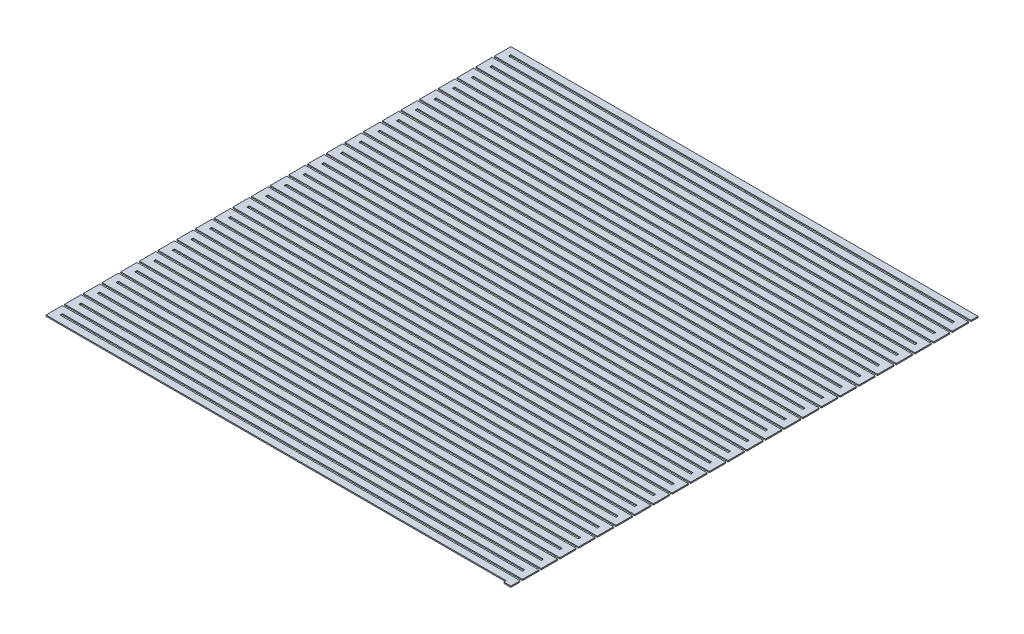
from build123d import *

# Parameters (mm, degrees)
EXTRUDED_OBJECT_DEPTH = 0.05
BOSS_EXTRUDE1_DEPTH   = 0.05
LPATTERN2_COUNT       = 24
LPATTERN2_PITCH       = 0.8
SKETCH4_W             = 0.3
SKETCH4_H             = 0.1
BOSS_EXTRUDE2_DEPTH   = 0.05


with BuildPart() as part:
    # TopBlock → Extruded object (new body)
    with BuildSketch(Plane(origin=(0, 0, 0), x_dir=(1, 0, 0), z_dir=(0, 1, 0))):
        Polygon((-10, 10), (-9.7, 10), (10, 10), (10, 9.7), (-9.7, 9.7), (-9.7, 9.6), (10, 9.6), (10, 9.3), (-10, 9.3), (-10, 9.6), (-10, 9.7), align=None)
    extrude(amount=EXTRUDED_OBJECT_DEPTH)

    # Sketch3 → Boss-Extrude1 (add)
    with BuildSketch(Plane(origin=(0, 0, 0), x_dir=(1, 0, 0), z_dir=(0, 1, 0))):
        Polygon((9.7, 9.2), (9.7, 9.3), (10, 9.3), (10, 8.9), (-9.7, 8.9), (-9.7, 8.8), (10, 8.8), (10, 8.5), (-10, 8.5), (-10, 9.2), align=None)
    boss_extrude1 = extrude(amount=BOSS_EXTRUDE1_DEPTH)

    # LPattern2: Boss-Extrude1 ×24
    with Locations(*[(0, 0, i * LPATTERN2_PITCH) for i in range(1, LPATTERN2_COUNT)]):
        add(boss_extrude1)

    # Sketch4 → Boss-Extrude2 (add)
    with BuildSketch(Plane(origin=(0, 0, 0), x_dir=(1, 0, 0), z_dir=(0, 1, 0))):
        with Locations((9.85, -9.95)):
            Rectangle(SKETCH4_W, SKETCH4_H)
    extrude(amount=BOSS_EXTRUDE2_DEPTH)


solid = part.part
